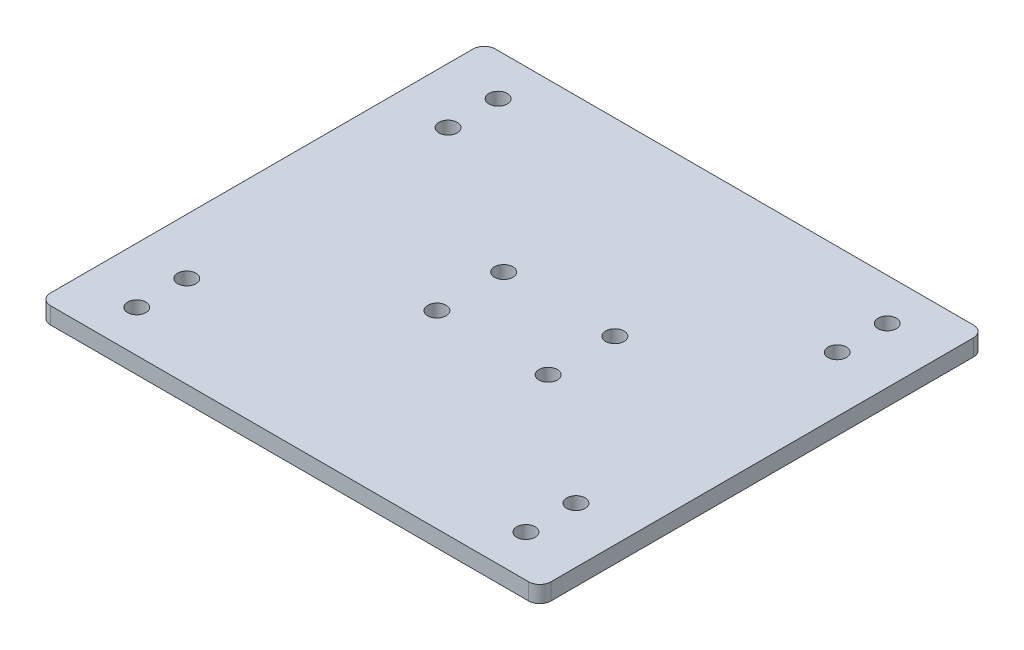
from build123d import *

# Parameters (mm, degrees)
SKETCH_1_W          = 90
SKETCH_1_H          = 80
EXTRUDE_1_DEPTH     = 1.5
SKETCH_2_R          = 1.65
CUT_EXTRUDE_1_DEPTH = 3
FILLET_1_R          = 2
SKETCH_3_R          = 1.65
CUT_EXTRUDE_2_DEPTH = 3


with BuildPart() as part:
    # 草图1 → 凸台-拉伸1 (new, symmetric)
    with BuildSketch(Plane(origin=(0, 0, 0), x_dir=(1, 0, 0), z_dir=(0, 1, 0))):
        Rectangle(SKETCH_1_W, SKETCH_1_H)
    extrude(amount=EXTRUDE_1_DEPTH, both=True)

    # 草图2 → 切除-拉伸1 (cut)
    with BuildSketch(Plane(origin=(0, 1.5, 0), x_dir=(1, 0, 0), z_dir=(0, 1, 0))):
        with Locations(Location((12.5, 6, 0), (0, 0, 270))):
            Circle(SKETCH_2_R)
        with Locations(Location((-7.5, 6, 0), (0, 0, 270))):
            Circle(SKETCH_2_R)
        with Locations(Location((-7.5, -6, 0), (0, 0, 270))):
            Circle(SKETCH_2_R)
        with Locations(Location((12.5, -6, 0), (0, 0, 270))):
            Circle(SKETCH_2_R)
    extrude(amount=-CUT_EXTRUDE_1_DEPTH, mode=Mode.SUBTRACT)

    # 圆角1
    fillet_1_edges = [part.edges().sort_by_distance(p)[0] for p in [
        (45, 0, 40),
        (-45, 0, 40),
        (-45, 0, -40),
        (45, 0, -40),
    ]]
    fillet(fillet_1_edges, radius=FILLET_1_R)

    # 草图3 → 切除-拉伸2 (cut)
    with BuildSketch(Plane(origin=(0, 1.5, 0), x_dir=(1, 0, 0), z_dir=(0, 1, 0))):
        with Locations(Location((35, 32.5, 0), (0, 0, 270))):
            Circle(SKETCH_3_R)
        with Locations(Location((35, 23.5, 0), (0, 0, 270))):
            Circle(SKETCH_3_R)
        with Locations(Location((35, -23.5, 0), (0, 0, 270))):
            Circle(SKETCH_3_R)
        with Locations(Location((35, -32.5, 0), (0, 0, 270))):
            Circle(SKETCH_3_R)
    cut_extrude_2 = extrude(amount=-CUT_EXTRUDE_2_DEPTH, mode=Mode.SUBTRACT)

    # 镜向1: 切除-拉伸2 across plane
    add(cut_extrude_2.mirror(Plane(origin=(0, 0, 0), x_dir=(0, 0, 1), z_dir=(1, 0, 0))), mode=Mode.SUBTRACT)

    # 镜向1 at the second plane: 切除-拉伸2 across plane
    add(cut_extrude_2.mirror(Plane.XY), mode=Mode.SUBTRACT)


solid = part.part
